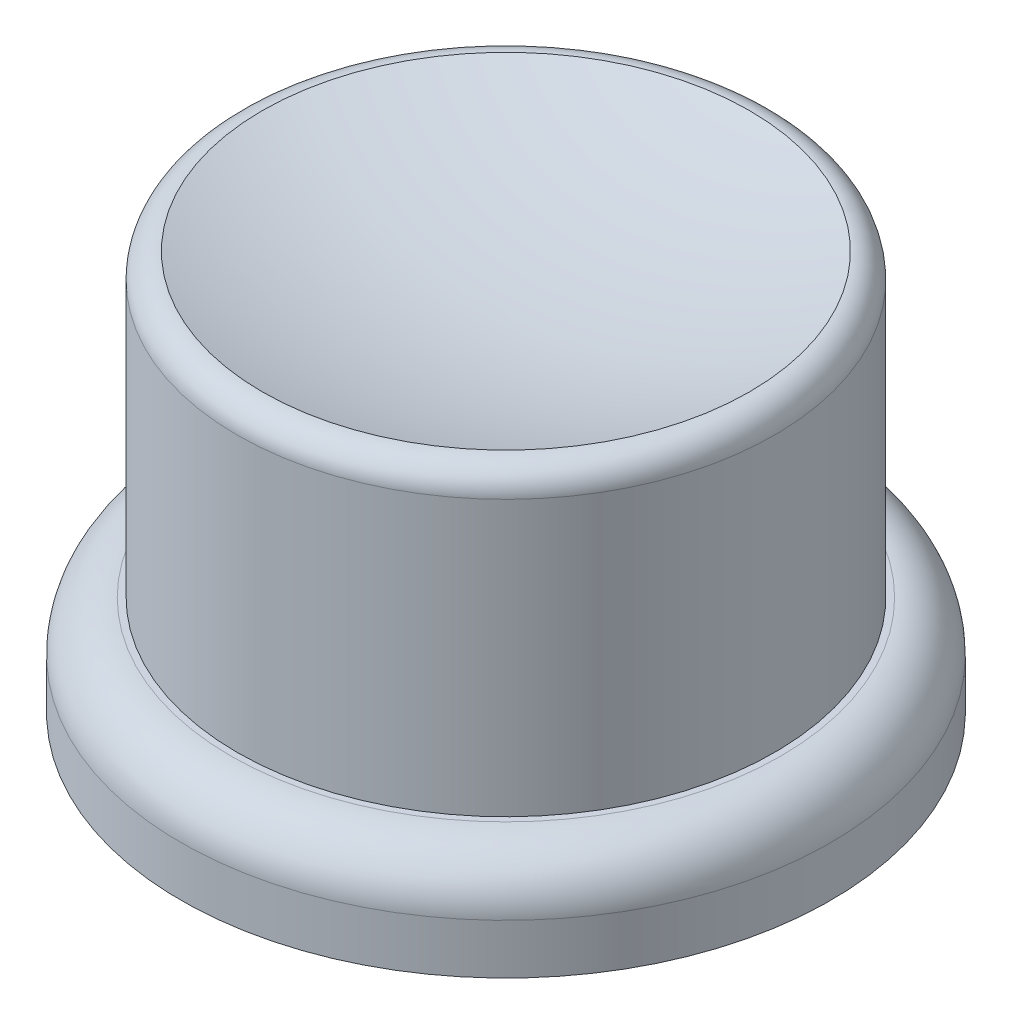
from build123d import *
from OCP.BRepFilletAPI import BRepFilletAPI_MakeFillet

# Parameters (mm, degrees)
CROQUIS1_R              = 5.375
SALIENTE_EXTRUIR1_DEPTH = 6
CROQUIS2_R              = 6.5
SALIENTE_EXTRUIR2_DEPTH = 2
VACIADO1_T              = -1
SALIENTE_EXTRUIR3_START = 4.5
CROQUIS3_R              = 4.375
SALIENTE_EXTRUIR3_DEPTH = 4.5
REDONDEO1_R1            = 0.5
REDONDEO1_R2            = 1


with BuildPart() as part:
    # Croquis1 → Saliente-Extruir1 (new body)
    with BuildSketch(Plane(origin=(0, 0, 0), x_dir=(1, 0, 0), z_dir=(0, 1, 0))):
        Circle(CROQUIS1_R)
    extrude(amount=SALIENTE_EXTRUIR1_DEPTH)

    # Croquis2 → Saliente-Extruir2 (add)
    with BuildSketch(Plane.XZ):
        Circle(CROQUIS2_R)
    extrude(amount=SALIENTE_EXTRUIR2_DEPTH)

    # Vaciado1
    vaciado1_openings = [part.faces().sort_by_distance(p)[0] for p in [
        (0, -2, 0),
    ]]
    offset(amount=VACIADO1_T, openings=vaciado1_openings, kind=Kind.INTERSECTION)

    # Croquis3 → Saliente-Extruir3 (add)
    with BuildSketch(Plane.XZ.offset(-5).offset(SALIENTE_EXTRUIR3_START)):
        Circle(CROQUIS3_R)
    extrude(amount=-SALIENTE_EXTRUIR3_DEPTH)

    # Redondeo1: one fillet with a radius per group of edges: ONE call of the kernel's fillet builder (fillet() takes one radius for all edges)
    redondeo1_edges_1 = [part.edges().sort_by_distance(p)[0] for p in [
        (-5.375, 6, 0),
    ]]
    redondeo1_edges_2 = [part.edges().sort_by_distance(p)[0] for p in [
        (-6.5, 0, 0),
    ]]
    redondeo1 = BRepFilletAPI_MakeFillet(part.part.solid().wrapped)
    for e in redondeo1_edges_1:
        redondeo1.Add(REDONDEO1_R1, e.wrapped)
    for e in redondeo1_edges_2:
        redondeo1.Add(REDONDEO1_R2, e.wrapped)
    add(Compound.cast(redondeo1.Shape()), mode=Mode.REPLACE)

    # Croquis4 → Cortar-Revolución4 (revolve, cut)
    with BuildSketch(Plane.XY):
        with BuildLine():
            Line((0, 20), (0, 5.175505911))
            ThreePointArc((0, 5.175505911), (-14.824494089, 20), (0, 34.824494089))
            Line((0, 34.824494089), (0, 20))
        make_face()
    revolve(axis=Axis((0, 20, 0), (0, -1, 0)), mode=Mode.SUBTRACT)


solid = part.part
